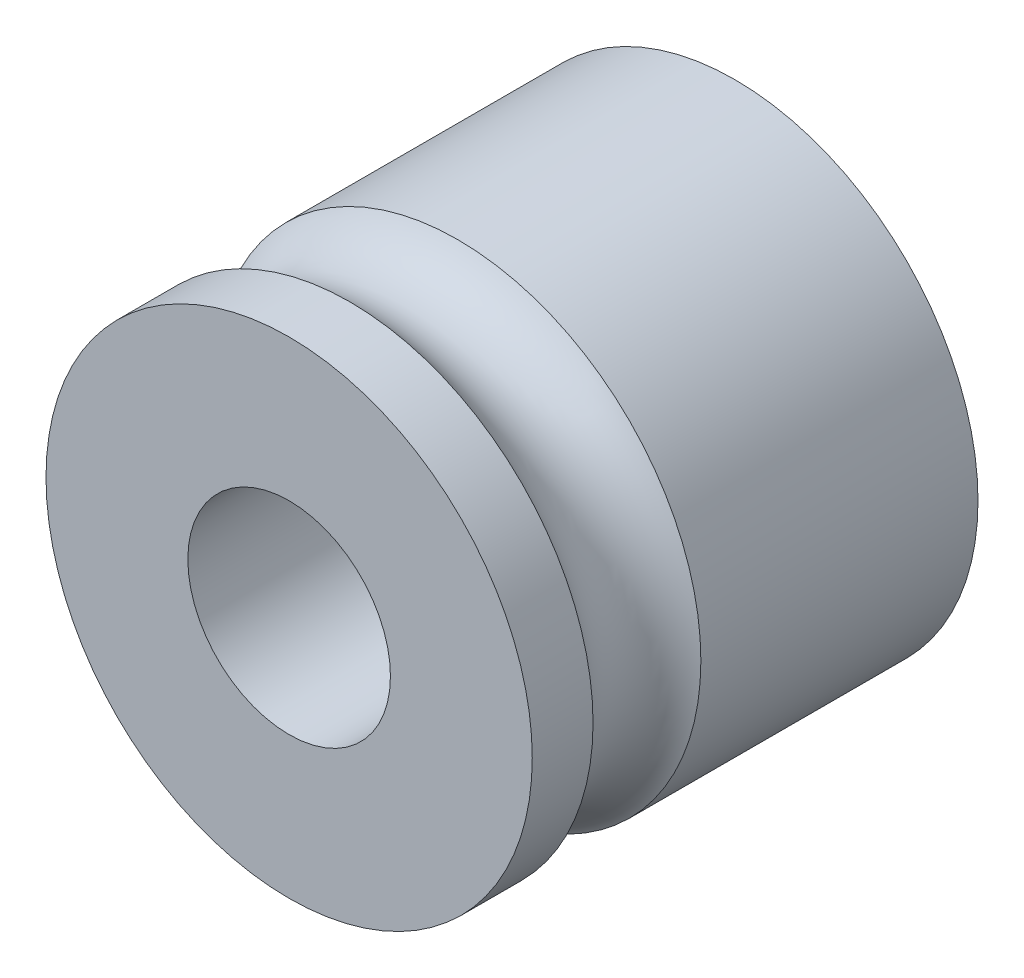
from build123d import *

# Parameters (mm, degrees)
SKICA1_R                 = 6
SKICA1_R_2               = 2.5
P_IDAT_VYSUNUT_M1_DEPTH  = 11
SKICA3_R                 = 1.5
ODEBRAT_VYSUNUT_M1_DEPTH = 11


with BuildPart() as part:
    # Skica1 → Přidat vysunutím1 (new body)
    with BuildSketch(Plane.XY):
        Circle(SKICA1_R)
        Circle(SKICA1_R_2, mode=Mode.SUBTRACT)
    extrude(amount=P_IDAT_VYSUNUT_M1_DEPTH)

    # Skica2 → Odebrat rotací1 (revolve, cut)
    with BuildSketch(Plane(origin=(0, 0, 0), x_dir=(0, 0, -1), z_dir=(1, 0, 0)), mode=Mode.PRIVATE) as odebrat_rotac_1_sk:
        with BuildLine():
            Line((-6.838910778, 6), (-9.5, 6))
            ThreePointArc((-9.5, 6), (-8.169455389, 5.25), (-6.838910778, 6))
        make_face()
    revolve(odebrat_rotac_1_sk.sketch.rotate(Axis((0, 0, 0), (0, 0, 1)), 90), axis=Axis((0, 0, 0), (0, 0, 1)), mode=Mode.SUBTRACT)

    # Skica3 → Odebrat vysunutím1 (cut)
    with BuildSketch(Plane(origin=(0, 0, 0), x_dir=(0, 0, -1), z_dir=(1, 0, 0))):
        with Locations(Location((-2.709871991, 0, 0), (0, 0, 180))):
            Circle(SKICA3_R)
    extrude(amount=-ODEBRAT_VYSUNUT_M1_DEPTH, mode=Mode.SUBTRACT)


solid = part.part
